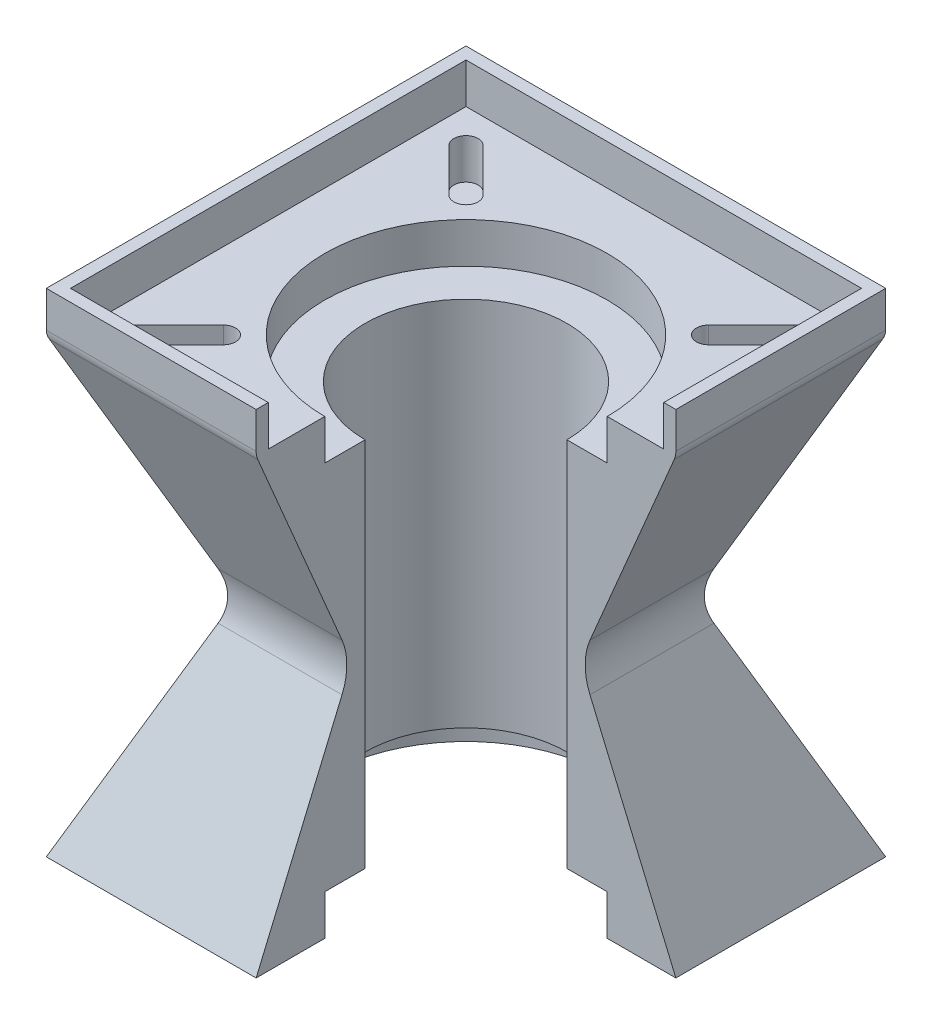
from build123d import *

# Parameters (mm, degrees)
ESQUISSE1_W                  = 104
ESQUISSE1_H                  = 104
BOSS_EXTRU_2_DEPTH           = 56
BOSS_EXTRU_2_DRAFT           = -23
SYM_TRIE1_COPY_1_SKETCH_W    = 104
SYM_TRIE1_COPY_1_SKETCH_H    = 104
SYM_TRIE1_COPY_1_DEPTH       = 56
SYM_TRIE1_COPY_1_DRAFT       = -23
ENL_V_MAT_EXTRU_1_DEPTH      = 134.985073796
ENL_V_MAT_EXTRU_1_DEPTH_BACK = 134.985073796
ESQUISSE2_R                  = 25
CONG_1_R                     = 15
ESQUISSE3_W                  = 52
ESQUISSE3_H                  = 52
ENL_V_MAT_EXTRU_2_DEPTH      = 134.985073796
ESQUISSE4_R                  = 35
ENL_V_MAT_EXTRU_3_DEPTH      = 10
BOSS_EXTRU_3_DEPTH           = 10
CONG_2_R                     = 5
ENL_V_MAT_EXTRU_4_DEPTH      = 10


with BuildPart() as part:
    # Esquisse1 → Boss.-Extru.2 (with draft: the straight prism first)
    with BuildSketch(Plane(origin=(0, 0, 0), x_dir=(1, 0, 0), z_dir=(0, 1, 0))):
        Rectangle(ESQUISSE1_W, ESQUISSE1_H)
    extrude(amount=-BOSS_EXTRU_2_DEPTH)
    # Boss.-Extru.2: the draft: its side faces are tilted about the plane it starts from
    boss_extru_2_sides = [part.faces().sort_by_distance(p)[0] for p in [
        (-52, -28, 0),
        (0, -28, 52),
        (52, -28, 0),
        (0, -28, -52),
    ]]
    draft(boss_extru_2_sides, Plane(origin=(0, 0, 0), x_dir=(1, 0, 0), z_dir=(0, 1, 0)), BOSS_EXTRU_2_DRAFT)


with BuildPart() as sym_trie1_copy_1_tool:
    # Symétrie1 copy 1 sketch → Symétrie1 copy 1 (with draft: the straight prism first)
    with BuildSketch(Plane.XZ.offset(112)):
        Rectangle(SYM_TRIE1_COPY_1_SKETCH_W, SYM_TRIE1_COPY_1_SKETCH_H)
    extrude(amount=-SYM_TRIE1_COPY_1_DEPTH)
    # Symétrie1 copy 1: the draft: its side faces are tilted about the plane it starts from
    sym_trie1_copy_1_sides = [sym_trie1_copy_1_tool.faces().sort_by_distance(p)[0] for p in [
        (-52, -84, 0),
        (0, -84, 52),
        (52, -84, 0),
        (0, -84, -52),
    ]]
    draft(sym_trie1_copy_1_sides, Plane.XZ.offset(112), SYM_TRIE1_COPY_1_DRAFT)


with BuildPart() as part_1:
    add(part.part)

    # Symétrie1 copy 1: add sym_trie1_copy_1_tool
    add(sym_trie1_copy_1_tool.part)

    # Esquisse2 → Enlèv. mat.-Extru.1 (cut, two sides: drawn at the far end of the back side and taken through both)
    with BuildSketch(Plane(origin=(0, 0, 0), x_dir=(1, 0, 0), z_dir=(0, 1, 0)).offset(-ENL_V_MAT_EXTRU_1_DEPTH_BACK)):
        with Locations(Location((0, 0, 0), (0, 0, 270))):
            Circle(ESQUISSE2_R)
    extrude(amount=ENL_V_MAT_EXTRU_1_DEPTH + ENL_V_MAT_EXTRU_1_DEPTH_BACK, mode=Mode.SUBTRACT)

    # Congé1
    cong_1_edges = [part_1.edges().sort_by_distance(p)[0] for p in [
        (-28.229410292, -56, 0),
        (0, -56, 28.229410292),
        (28.229410292, -56, 0),
        (0, -56, -28.229410292),
    ]]
    fillet(cong_1_edges, radius=CONG_1_R)

    # Esquisse3 → Enlèv. mat.-Extru.2 (cut, through all)
    with BuildSketch(Plane(origin=(0, 0, 0), x_dir=(1, 0, 0), z_dir=(0, 1, 0))):
        with Locations((26, -26)):
            Rectangle(ESQUISSE3_W, ESQUISSE3_H)
    extrude(amount=-ENL_V_MAT_EXTRU_2_DEPTH, mode=Mode.SUBTRACT)

    # Esquisse4 → Enlèv. mat.-Extru.3 (cut)
    with BuildSketch(Plane(origin=(0, 0, 0), x_dir=(1, 0, 0), z_dir=(0, 1, 0))):
        Circle(ESQUISSE4_R)
    enl_v_mat_extru_3 = extrude(amount=-ENL_V_MAT_EXTRU_3_DEPTH, mode=Mode.SUBTRACT)

    # Symétrie2: Enlèv. mat.-Extru.3 across plane
    add(enl_v_mat_extru_3.mirror(Plane.ZX.offset(-56)), mode=Mode.SUBTRACT)

    # Esquisse7 → Boss.-Extru.3 (add)
    with BuildSketch(Plane(origin=(0, 0, 0), x_dir=(1, 0, 0), z_dir=(0, 1, 0))):
        Polygon((-52, -52), (0, -52), (0, -49), (-49, -49), (-49, 49), (49, 49), (49, 0), (52, 0), (52, 52), (-52, 52), align=None)
    extrude(amount=BOSS_EXTRU_3_DEPTH)

    # Congé2
    cong_2_edges = [part_1.edges().sort_by_distance(p)[0] for p in [
        (-26, 0, 52),
        (-52, 0, 0),
        (0, 0, -52),
        (52, 0, -26),
    ]]
    fillet(cong_2_edges, radius=CONG_2_R)

    # Esquisse8 → Enlèv. mat.-Extru.4 (cut)
    with BuildSketch(Plane(origin=(0, 0, 0), x_dir=(1, 0, 0), z_dir=(0, 1, 0))):
        with BuildLine():
            Line((-38.537319575, 42.779960262), (-27.930717857, 32.173358544))
            ThreePointArc((-27.930717857, 32.173358544), (-27.930717857, 27.930717857), (-32.173358544, 27.930717857))
            Line((-32.173358544, 27.930717857), (-42.779960262, 38.537319575))
            ThreePointArc((-42.779960262, 38.537319575), (-42.779960262, 42.779960262), (-38.537319575, 42.779960262))
        make_face()
        with BuildLine():
            Line((42.779960262, 38.537319575), (32.173358544, 27.930717857))
            ThreePointArc((32.173358544, 27.930717857), (27.930717857, 27.930717857), (27.930717857, 32.173358544))
            Line((27.930717857, 32.173358544), (38.537319575, 42.779960262))
            ThreePointArc((38.537319575, 42.779960262), (42.779960262, 42.779960262), (42.779960262, 38.537319575))
        make_face()
        with BuildLine():
            Line((38.537319575, -42.779960262), (27.930717857, -32.173358544))
            ThreePointArc((27.930717857, -32.173358544), (27.930717857, -27.930717857), (32.173358544, -27.930717857))
            Line((32.173358544, -27.930717857), (42.779960262, -38.537319575))
            ThreePointArc((42.779960262, -38.537319575), (42.779960262, -42.779960262), (38.537319575, -42.779960262))
        make_face()
        with BuildLine():
            Line((-42.779960262, -38.537319575), (-32.173358544, -27.930717857))
            ThreePointArc((-32.173358544, -27.930717857), (-27.930717857, -27.930717857), (-27.930717857, -32.173358544))
            Line((-27.930717857, -32.173358544), (-38.537319575, -42.779960262))
            ThreePointArc((-38.537319575, -42.779960262), (-42.779960262, -42.779960262), (-42.779960262, -38.537319575))
        make_face()
    extrude(amount=-ENL_V_MAT_EXTRU_4_DEPTH, mode=Mode.SUBTRACT)


solid = part_1.part
